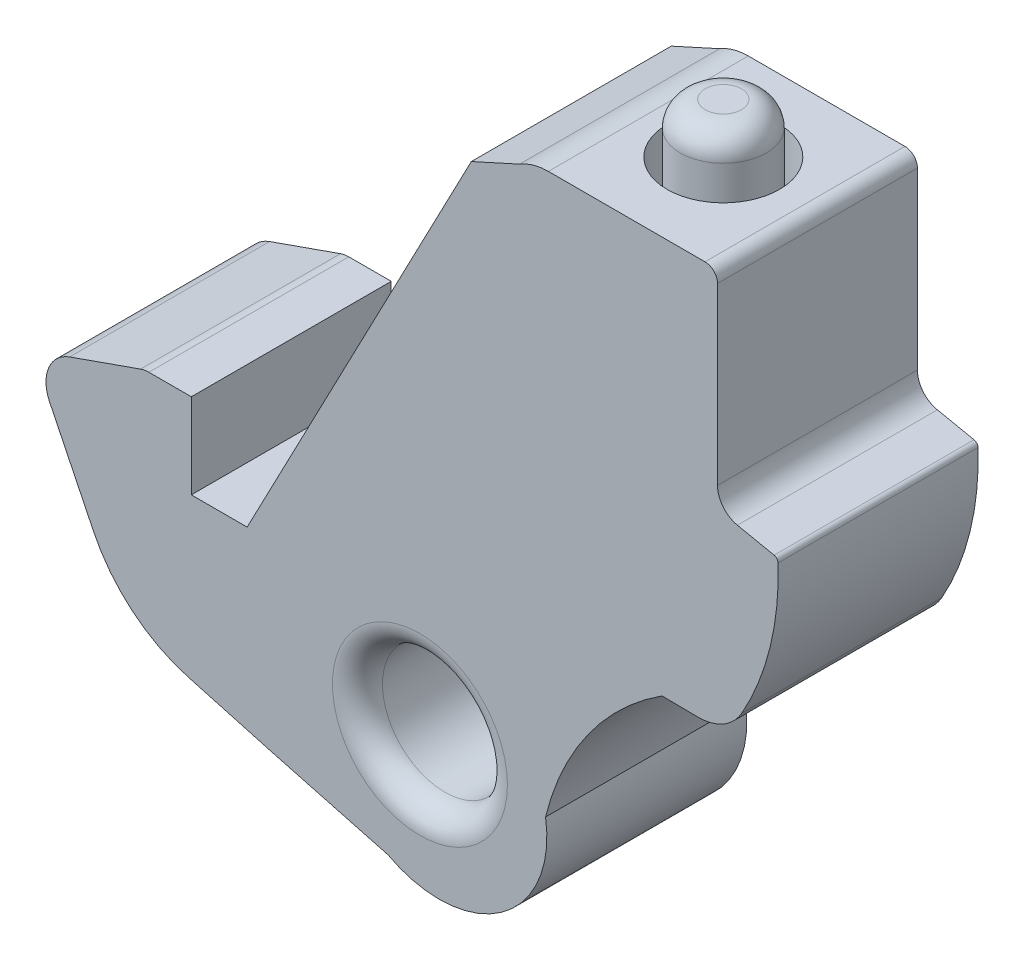
from build123d import *

# Parameters (mm, degrees)
SKETCH_2_R          = 2.5
EXTRUDE_1_DEPTH     = 8
SKETCH_9_R          = 2.25
CUT_EXTRUDE_6_DEPTH = 2
SKETCH_10_R         = 1.725
EXTRUDE_3_DEPTH     = 4
FILLET_9_R          = 1
FILLET_6_R          = 1
FILLET_11_R         = 0.5


with BuildPart() as part:
    # 스케치2 → 보스-돌출1 (new body)
    with BuildSketch(Plane.XY):
        with BuildLine():
            Line((8.317867543, 16.224371176), (13.7243035, 16.224371176))
            Line((13.7243035, 16.224371176), (15.084656802, 16.224371176))
            Line((15.084656802, 16.224371176), (15.084656802, 8.724371176))
            ThreePointArc((15.084656802, 8.724371176), (15.309326229, 8.092815555), (15.882381806, 7.745042413))
            Line((15.882381806, 7.745042413), (17.349168707, 7.442085607))
            ThreePointArc((17.349168707, 7.442085607), (17.461588205, 7.375174839), (17.508595785, 7.253086831))
            ThreePointArc((17.508595785, 7.253086831), (17.192711955, 4.187660486), (16.059003603, 1.322119239))
            ThreePointArc((16.059003603, 1.322119239), (15.315387006, 0.571939712), (14.29334298, 0.305179564))
            Line((14.29334298, 0.305179564), (12.864118803, 0.322230851))
            ThreePointArc((12.864118803, 0.322230851), (9.906475316, -2.49254573), (8.205466836, -6.204309777))
            ThreePointArc((8.205466836, -6.204309777), (6.437083645, -10.39249276), (1.899177239, -10.667194879))
            Line((1.899177239, -10.667194879), (-2.713922879, -9.439136425))
            Line((-2.713922879, -9.439136425), (-6.086658366, -8.506851574))
            ThreePointArc((-6.086658366, -8.506851574), (-8.323670203, -7.337653763), (-9.881865945, -5.351886527))
            Line((-9.881865945, -5.351886527), (-11.641875294, -1.739829609))
            ThreePointArc((-11.641875294, -1.739829609), (-11.678836202, -0.582101362), (-10.839032567, 0.21566468))
            Line((-10.839032567, 0.21566468), (-7.999803479, 1.214399245))
            ThreePointArc((-7.999803479, 1.214399245), (-7.836289234, 1.256793405), (-7.667972201, 1.271060492))
            Line((-7.667972201, 1.271060492), (-5.969536129, 1.271060492))
            Line((-5.969536129, 1.271060492), (-5.969536129, -2.128939508))
            Line((-5.969536129, -2.128939508), (-3.73592311, -2.128939508))
            Line((-3.73592311, -2.128939508), (5.234762536, 15.024331657))
            Line((5.234762536, 15.024331657), (7.166939789, 15.900622709))
            ThreePointArc((7.166939789, 15.900622709), (7.720069967, 16.141893375), (8.317867543, 16.224371176))
        make_face()
        with Locations((3.179026074, -5.859548474)):
            Circle(SKETCH_2_R, mode=Mode.SUBTRACT)
    extrude(amount=EXTRUDE_1_DEPTH)

    # 스케치9 → 컷-돌출6 (cut)
    with BuildSketch(Plane(origin=(0, 16.224371176, 0), x_dir=(1, 0, 0), z_dir=(0, 1, 0))):
        with Locations(Location((11.317867543, -4, 0), (0, 0, 270))):
            Circle(SKETCH_9_R)
    extrude(amount=-CUT_EXTRUDE_6_DEPTH, mode=Mode.SUBTRACT)

    # 스케치10 → 보스-돌출3 (add)
    with BuildSketch(Plane(origin=(0, 14.224371176, 0), x_dir=(1, 0, 0), z_dir=(0, 1, 0))):
        with Locations(Location((11.317867543, -4, 0), (0, 0, 270))):
            Circle(SKETCH_10_R)
    extrude(amount=EXTRUDE_3_DEPTH)

    # 필렛9
    fillet_9_edges = [part.edges().sort_by_distance(p)[0] for p in [
        (11.317867543, 18.224371176, 2.275),
    ]]
    fillet(fillet_9_edges, radius=FILLET_9_R)

    # 필렛6
    fillet_6_edges = [part.edges().sort_by_distance(p)[0] for p in [
        (0.679026074, -5.859548474, 0),
        (0.679026074, -5.859548474, 8),
    ]]
    fillet(fillet_6_edges, radius=FILLET_6_R)

    # 필렛11
    fillet_11_edges = [part.edges().sort_by_distance(p)[0] for p in [
        (15.084656802, 16.224371176, 4),
    ]]
    fillet(fillet_11_edges, radius=FILLET_11_R)


solid = part.part
